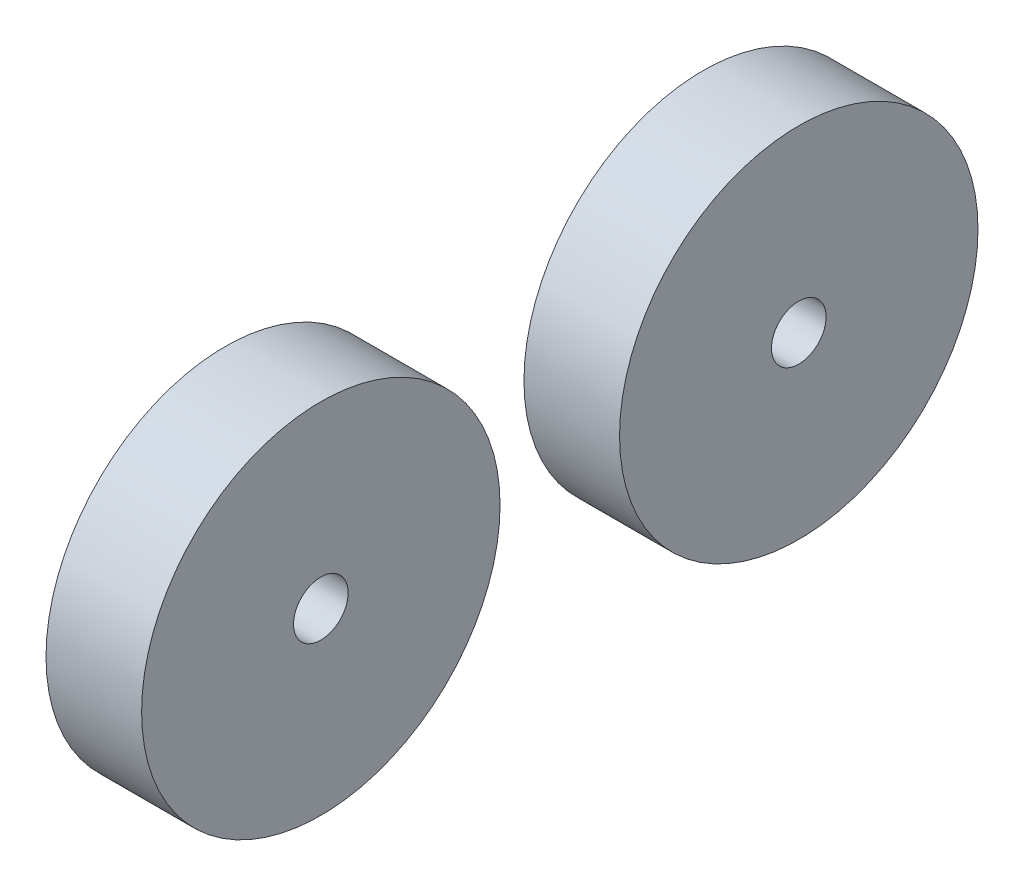
from build123d import *

# Parameters (mm, degrees)
SKETCH1_R             = 15
SKETCH1_R_2           = 2.286
BOSS_EXTRUDE2_DEPTH   = 8
BOSS_EXTRUDE2_2_DEPTH = 8


with BuildPart() as part:
    # Sketch1 → Boss-Extrude2 (new body)
    with BuildSketch(Plane(origin=(0, 0, 0), x_dir=(0, 0, -1), z_dir=(1, 0, 0))):
        with Locations((-20, 0)):
            Circle(SKETCH1_R)
        with Locations((-20, 0)):
            Circle(SKETCH1_R_2, mode=Mode.SUBTRACT)
    extrude(amount=BOSS_EXTRUDE2_DEPTH)


with BuildPart() as body_2:
    # Sketch1 → Boss-Extrude2 2 (new body)
    with BuildSketch(Plane(origin=(0, 0, 0), x_dir=(0, 0, -1), z_dir=(1, 0, 0))):
        with Locations((20, 0)):
            Circle(SKETCH1_R)
        with Locations((20, 0)):
            Circle(SKETCH1_R_2, mode=Mode.SUBTRACT)
    extrude(amount=BOSS_EXTRUDE2_2_DEPTH)


solid = Compound([part.part, body_2.part])
